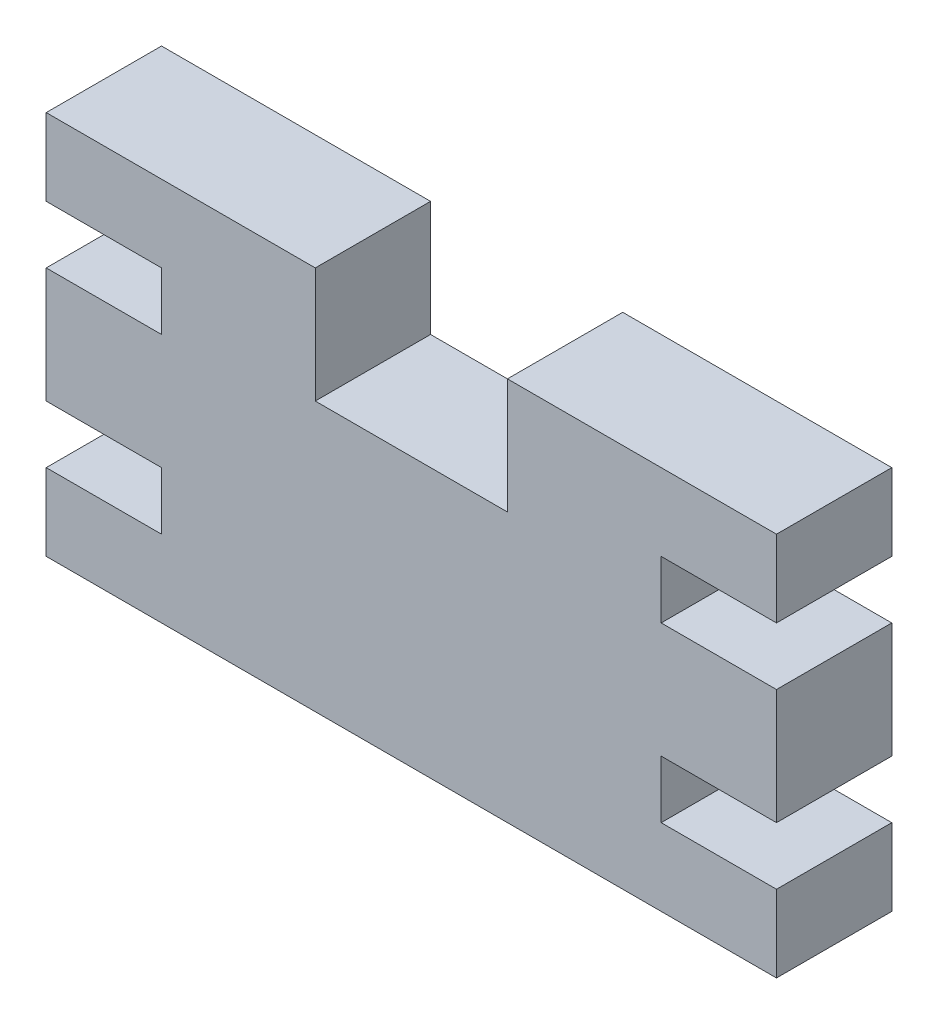
from build123d import *

# Parameters (mm, degrees)
SKETCH1_W           = 19
SKETCH1_H           = 10
BOSS_EXTRUDE1_DEPTH = 3
SKETCH2_W           = 3
SKETCH2_H           = 1.5
CUT_EXTRUDE1_DEPTH  = 3
SKETCH3_W           = 3
SKETCH3_H           = 1.5
CUT_EXTRUDE2_DEPTH  = 3
SKETCH5_W           = 5
SKETCH5_H           = 3
CUT_EXTRUDE6_DEPTH  = 3


with BuildPart() as part:
    # Sketch1 → Boss-Extrude1 (new body)
    with BuildSketch(Plane.XY):
        with Locations((3, 9.633458647)):
            Rectangle(SKETCH1_W, SKETCH1_H)
    extrude(amount=BOSS_EXTRUDE1_DEPTH)

    # Sketch2 → Cut-Extrude1 (cut)
    with BuildSketch(Plane.XY.offset(3)):
        with Locations((-5, 11.883458647)):
            Rectangle(SKETCH2_W, SKETCH2_H)
        with Locations((-5, 7.383458647)):
            Rectangle(SKETCH2_W, SKETCH2_H)
    extrude(amount=-CUT_EXTRUDE1_DEPTH, mode=Mode.SUBTRACT)

    # Sketch3 → Cut-Extrude2 (cut)
    with BuildSketch(Plane.XY.offset(3)):
        with Locations((11, 11.883458647)):
            Rectangle(SKETCH3_W, SKETCH3_H)
        with Locations((11, 7.383458647)):
            Rectangle(SKETCH3_W, SKETCH3_H)
    extrude(amount=-CUT_EXTRUDE2_DEPTH, mode=Mode.SUBTRACT)

    # Sketch5 → Cut-Extrude6 (cut)
    with BuildSketch(Plane.XY.offset(3)):
        with Locations((3, 13.133458647)):
            Rectangle(SKETCH5_W, SKETCH5_H)
    extrude(amount=-CUT_EXTRUDE6_DEPTH, mode=Mode.SUBTRACT)


solid = part.part
